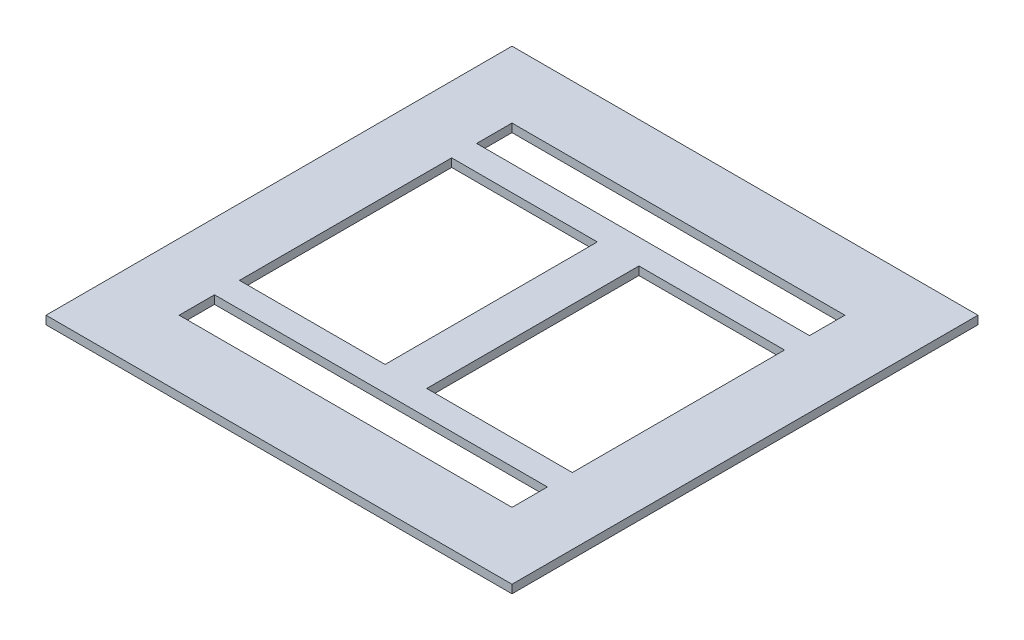
from build123d import *

# Parameters (mm, degrees)
SKETCH4_W           = 112
SKETCH4_H           = 112
SKETCH4_W_2         = 35
SKETCH4_H_2         = 51
SKETCH4_W_3         = 79.99998991
SKETCH4_H_3         = 8.5
BOSS_EXTRUDE1_DEPTH = 2


with BuildPart() as part:
    # Sketch4 → Boss-Extrude1 (new body)
    with BuildSketch(Plane(origin=(0, 0, 0), x_dir=(1, 0, 0), z_dir=(0, 1, 0))):
        with Locations((1.0658e-05, 0)):
            Rectangle(SKETCH4_W, SKETCH4_H)
        with Locations((22.500011716, 0)):
            Rectangle(SKETCH4_W_2, SKETCH4_H_2, mode=Mode.SUBTRACT)
        with Locations((6.671e-06, -35.75)):
            Rectangle(SKETCH4_W_3, SKETCH4_H_3, mode=Mode.SUBTRACT)
        with Locations((-22.499988284, 0)):
            Rectangle(SKETCH4_W_2, SKETCH4_H_2, mode=Mode.SUBTRACT)
        with Locations((6.671e-06, 35.75)):
            Rectangle(SKETCH4_W_3, SKETCH4_H_3, mode=Mode.SUBTRACT)
    extrude(amount=BOSS_EXTRUDE1_DEPTH)


solid = part.part
